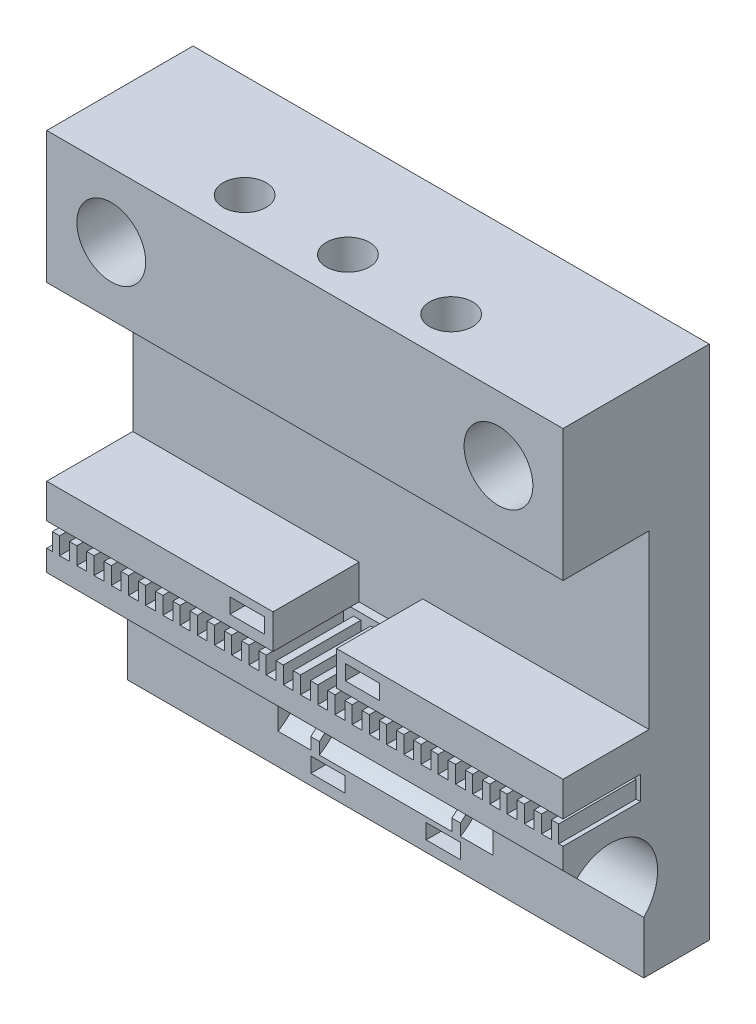
from build123d import *

# Parameters (mm, degrees)
SKETCH1_W           = 60
SKETCH1_H           = 17
BOSS_EXTRUDE2_DEPTH = 60
SKETCH5_R           = 7.5
CUT_EXTRUDE3_DEPTH  = 12.5
BOSS_EXTRUDE5_START = 1
SKETCH7_R           = 7.5
SKETCH7_R_2         = 6.375
BOSS_EXTRUDE5_DEPTH = 1
SKETCH8_R           = 7.5
SKETCH8_R_2         = 6.375
BOSS_EXTRUDE6_DEPTH = 1
SKETCH3_W           = 14.616308542
SKETCH3_H           = 2.75
CUT_EXTRUDE2_DEPTH  = 87.539008545
SKETCH9_W           = 29.365083629
SKETCH9_H           = 1.75
SKETCH9_W_2         = 26.887211927
CUT_EXTRUDE4_DEPTH  = 4
SKETCH10_W          = 36.539507471
SKETCH10_H          = 1.75
SKETCH10_W_2        = 38.625095797
CUT_EXTRUDE5_DEPTH  = 4
SKETCH12_W          = 0.85
SKETCH12_H          = 2
BOSS_EXTRUDE7_DEPTH = 9
CUT_EXTRUDE6_DEPTH  = 10
SKETCH14_R          = 4
CUT_EXTRUDE7_DEPTH  = 15
SKETCH15_R          = 2.5
CUT_EXTRUDE8_DEPTH  = 15.3


with BuildPart() as part:
    # Sketch1 → Boss-Extrude2 (new body)
    with BuildSketch(Plane(origin=(0, 0, 0), x_dir=(1, 0, 0), z_dir=(0, 1, 0))):
        with Locations((30, 8.5)):
            Rectangle(SKETCH1_W, SKETCH1_H)
    extrude(amount=BOSS_EXTRUDE2_DEPTH)

    # Sketch5 → Cut-Extrude3 (cut, symmetric)
    with BuildSketch(Plane(origin=(30, 0, 0), x_dir=(0, 0, -1), z_dir=(1, 0, 0))):
        with Locations((5.5, 10)):
            Circle(SKETCH5_R)
    extrude(amount=CUT_EXTRUDE3_DEPTH, both=True, mode=Mode.SUBTRACT)

    # Sketch7 → Boss-Extrude5 (add)
    with BuildSketch(Plane(origin=(21.3, 0, 0), x_dir=(0, 0, -1), z_dir=(1, 0, 0)).offset(BOSS_EXTRUDE5_START)):
        with Locations((5.5, 10)):
            Circle(SKETCH7_R)
        with Locations((5.5, 10)):
            Circle(SKETCH7_R_2, mode=Mode.SUBTRACT)
    extrude(amount=-BOSS_EXTRUDE5_DEPTH)

    # Sketch8 → Boss-Extrude6 (add)
    with BuildSketch(Plane.ZY.offset(-38.7)):
        with Locations((-5.5, 10)):
            Circle(SKETCH8_R)
        with Locations(Location((-5.5, 10, 0), (0, 0, 180))):
            Circle(SKETCH8_R_2, mode=Mode.SUBTRACT)
    extrude(amount=BOSS_EXTRUDE6_DEPTH)

    # Sketch3 → Cut-Extrude2 (cut, through all)
    with BuildSketch(Plane(origin=(60, 0, 0), x_dir=(0, 0, -1), z_dir=(1, 0, 0))):
        with BuildLine():
            Line((0, 15.5), (-6.640665203, 15.5))
            Line((-6.640665203, 15.5), (-6.640665203, 0))
            Line((-6.640665203, 0), (0, 0))
            Line((0, 0), (9.389087297, 0))
            Line((9.389087297, 0), (9.389087297, 6.110912703))
            ThreePointArc((9.389087297, 6.110912703), (9.389087297, 13.889087297), (1.610912703, 13.889087297))
            Line((1.610912703, 13.889087297), (0, 15.5))
        make_face()
        with Locations((1.691845729, 19.325)):
            Rectangle(SKETCH3_W, SKETCH3_H)
    extrude(amount=-CUT_EXTRUDE2_DEPTH, mode=Mode.SUBTRACT)

    # Sketch9 → Cut-Extrude4 (cut)
    with BuildSketch(Plane(origin=(21.3, 0, 0), x_dir=(0, 0, -1), z_dir=(1, 0, 0))):
        with Locations((7.065771792, 2.125)):
            Rectangle(SKETCH9_W, SKETCH9_H)
        with Locations((6.15524604, 22.825)):
            Rectangle(SKETCH9_W_2, SKETCH9_H)
    extrude(amount=CUT_EXTRUDE4_DEPTH, mode=Mode.SUBTRACT)

    # Sketch10 → Cut-Extrude5 (cut)
    with BuildSketch(Plane.ZY.offset(-38.7)):
        with Locations((-12.469654385, 22.825)):
            Rectangle(SKETCH10_W, SKETCH10_H)
        with Locations((-10.676048425, 2.125)):
            Rectangle(SKETCH10_W_2, SKETCH10_H)
    extrude(amount=CUT_EXTRUDE5_DEPTH, mode=Mode.SUBTRACT)

    # Sketch12 → Boss-Extrude7 (add)
    with BuildSketch(Plane.XY.offset(-9)):
        with Locations((59.075, 18.95)):
            Rectangle(SKETCH12_W, SKETCH12_H)
        with Locations((57.075, 18.95)):
            Rectangle(SKETCH12_W, SKETCH12_H)
        with Locations((55.075, 18.95)):
            Rectangle(SKETCH12_W, SKETCH12_H)
        with Locations((53.075, 18.95)):
            Rectangle(SKETCH12_W, SKETCH12_H)
        with Locations((51.075, 18.95)):
            Rectangle(SKETCH12_W, SKETCH12_H)
        with Locations((49.075, 18.95)):
            Rectangle(SKETCH12_W, SKETCH12_H)
        with Locations((47.075, 18.95)):
            Rectangle(SKETCH12_W, SKETCH12_H)
        with Locations((45.075, 18.95)):
            Rectangle(SKETCH12_W, SKETCH12_H)
        with Locations((43.075, 18.95)):
            Rectangle(SKETCH12_W, SKETCH12_H)
        with Locations((41.075, 18.95)):
            Rectangle(SKETCH12_W, SKETCH12_H)
        with Locations((39.075, 18.95)):
            Rectangle(SKETCH12_W, SKETCH12_H)
        with Locations((37.075, 18.95)):
            Rectangle(SKETCH12_W, SKETCH12_H)
        with Locations((35.075, 18.95)):
            Rectangle(SKETCH12_W, SKETCH12_H)
        with Locations((33.075, 18.95)):
            Rectangle(SKETCH12_W, SKETCH12_H)
        with Locations((31.075, 18.95)):
            Rectangle(SKETCH12_W, SKETCH12_H)
        with Locations((29.075, 18.95)):
            Rectangle(SKETCH12_W, SKETCH12_H)
        with Locations((27.075, 18.95)):
            Rectangle(SKETCH12_W, SKETCH12_H)
        with Locations((25.075, 18.95)):
            Rectangle(SKETCH12_W, SKETCH12_H)
        with Locations((23.075, 18.95)):
            Rectangle(SKETCH12_W, SKETCH12_H)
        with Locations((21.075, 18.95)):
            Rectangle(SKETCH12_W, SKETCH12_H)
        with Locations((19.075, 18.95)):
            Rectangle(SKETCH12_W, SKETCH12_H)
        with Locations((17.075, 18.95)):
            Rectangle(SKETCH12_W, SKETCH12_H)
        with Locations((15.075, 18.95)):
            Rectangle(SKETCH12_W, SKETCH12_H)
        with Locations((13.075, 18.95)):
            Rectangle(SKETCH12_W, SKETCH12_H)
        with Locations((11.075, 18.95)):
            Rectangle(SKETCH12_W, SKETCH12_H)
        with Locations((9.075, 18.95)):
            Rectangle(SKETCH12_W, SKETCH12_H)
        with Locations((7.075, 18.95)):
            Rectangle(SKETCH12_W, SKETCH12_H)
        with Locations((5.075, 18.95)):
            Rectangle(SKETCH12_W, SKETCH12_H)
        with Locations((3.075, 18.95)):
            Rectangle(SKETCH12_W, SKETCH12_H)
        with Locations((1.075, 18.95)):
            Rectangle(SKETCH12_W, SKETCH12_H)
    extrude(amount=BOSS_EXTRUDE7_DEPTH)

    # Sketch13 → Cut-Extrude6 (cut)
    with BuildSketch(Plane.XY):
        Polygon((33.7, 24.7), (33.7, 20.7), (26.3, 20.7), (26.3, 24.7), (-1.390912484, 24.7), (-1.390912484, 44.7), (62.591854088, 44.7), (62.591854088, 24.7), align=None)
    extrude(amount=-CUT_EXTRUDE6_DEPTH, mode=Mode.SUBTRACT)

    # Sketch14 → Cut-Extrude7 (cut)
    with BuildSketch(Plane.XY):
        with Locations((7.5, 52.5)):
            Circle(SKETCH14_R)
        with Locations((52.5, 52.5)):
            Circle(SKETCH14_R)
    extrude(amount=-CUT_EXTRUDE7_DEPTH, mode=Mode.SUBTRACT)

    # Sketch15 → Cut-Extrude8 (cut)
    with BuildSketch(Plane.XZ.offset(-44.7)):
        with Locations(Location((30, -5, 0), (0, 0, 270))):
            Circle(SKETCH15_R)
        with Locations(Location((18, -5, 0), (0, 0, 270))):
            Circle(SKETCH15_R)
        with Locations(Location((42, -5, 0), (0, 0, 270))):
            Circle(SKETCH15_R)
    extrude(amount=-CUT_EXTRUDE8_DEPTH, mode=Mode.SUBTRACT)


solid = part.part
